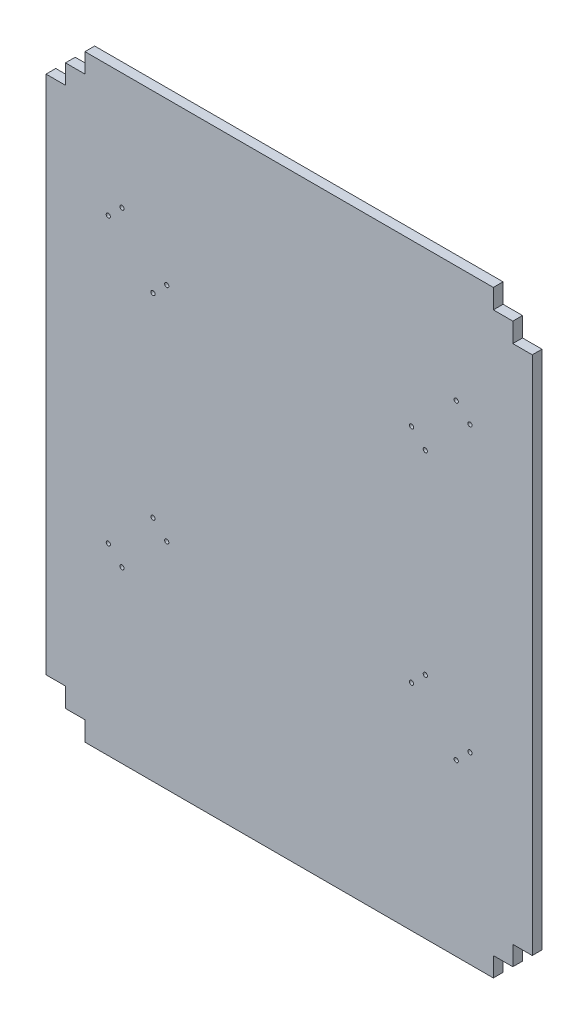
from build123d import *

# Parameters (mm, degrees)
EXTRUDE_1_DEPTH     = 10
SKETCH_2_R          = 2.15
CUT_EXTRUDE_1_DEPTH = 10


with BuildPart() as part:
    # 草图1 → 凸台-拉伸1 (new body)
    with BuildSketch(Plane.XY):
        Polygon((0, 0), (0, -535), (20, -535), (20, -555), (40, -555), (40, -575), (460, -575), (460, -555), (480, -555), (480, -535), (500, -535), (500, 0), (480, 0), (480, 20), (460, 20), (460, 40), (40, 40), (40, 20), (20, 20), (20, 0), align=None)
    extrude(amount=EXTRUDE_1_DEPTH)

    # 草图2 → 切除-拉伸1 (cut)
    with BuildSketch(Plane.XY.offset(10)):
        with Locations((64.038059223, -94.038059223)):
            Circle(SKETCH_2_R)
        with Locations((78.180194847, -79.895923599)):
            Circle(SKETCH_2_R)
        with Locations((110, -140)):
            Circle(SKETCH_2_R)
        with Locations((124.142135624, -125.857864376)):
            Circle(SKETCH_2_R)
        with Locations((390, -140)):
            Circle(SKETCH_2_R)
        with Locations((375.857864376, -125.857864376)):
            Circle(SKETCH_2_R)
        with Locations((435.961940777, -94.038059223)):
            Circle(SKETCH_2_R)
        with Locations(Location((421.819805153, -79.895923599, 0), (0, 0, 180))):
            Circle(SKETCH_2_R)
        with Locations((421.819805153, -400.104076401)):
            Circle(SKETCH_2_R)
        with Locations((435.961940777, -385.961940777)):
            Circle(SKETCH_2_R)
        with Locations((375.857864376, -354.142135624)):
            Circle(SKETCH_2_R)
        with Locations((390, -340)):
            Circle(SKETCH_2_R)
        with Locations(Location((124.142135624, -354.142135624, 0), (0, 0, 180))):
            Circle(SKETCH_2_R)
        with Locations(Location((110, -340, 0), (0, 0, 180))):
            Circle(SKETCH_2_R)
        with Locations((78.180194847, -400.104076401)):
            Circle(SKETCH_2_R)
        with Locations((64.038059223, -385.961940777)):
            Circle(SKETCH_2_R)
    extrude(amount=-CUT_EXTRUDE_1_DEPTH, mode=Mode.SUBTRACT)


solid = part.part
